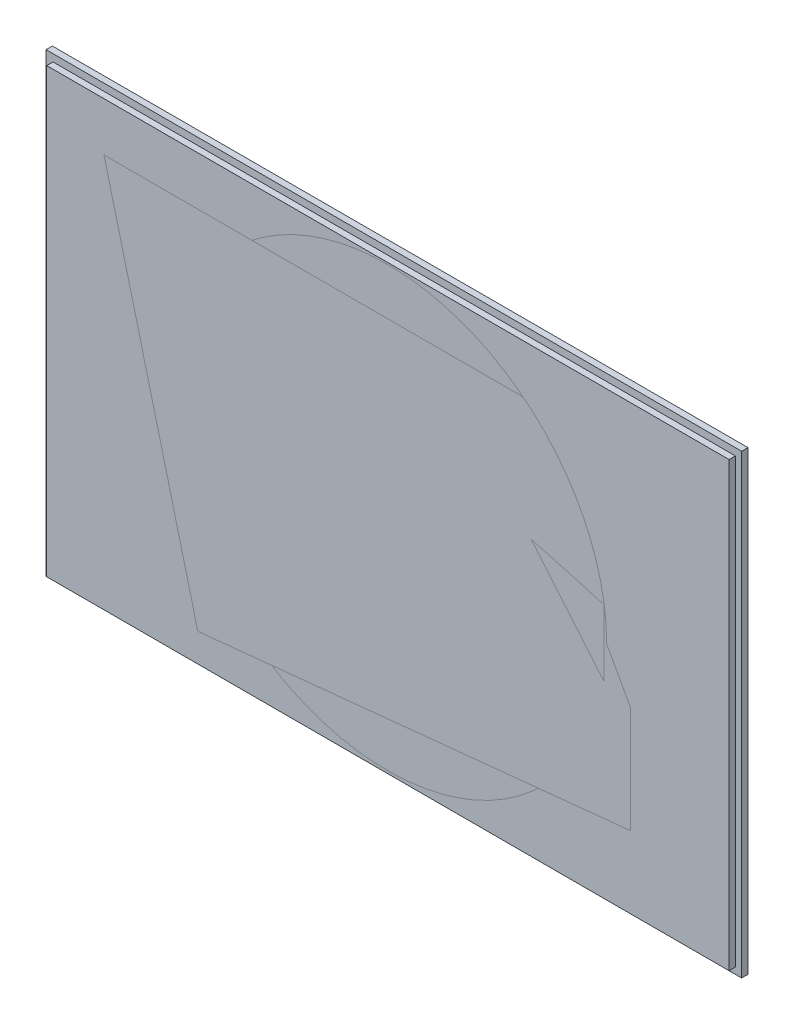
from build123d import *

# Parameters (mm, degrees)
SKETCH1_W           = 219.763537348
SKETCH1_H           = 144.111604492
BOSS_EXTRUDE1_DEPTH = 2
BOSS_EXTRUDE2_DEPTH = 2
SKETCH3_W           = 215.561595081
SKETCH3_H           = 139.864383785
BOSS_EXTRUDE3_DEPTH = 2
SKETCH4_R           = 69.248780579
BOSS_EXTRUDE5_DEPTH = 2
SKETCH4_2_R         = 69.248780579
CUT_EXTRUDE3_DEPTH  = 2


with BuildPart() as part:
    # Sketch1 → Boss-Extrude1 (new body)
    with BuildSketch(Plane.XY):
        Rectangle(SKETCH1_W, SKETCH1_H)
    extrude(amount=BOSS_EXTRUDE1_DEPTH)


with BuildPart() as body_2:
    # Sketch2 → Boss-Extrude2 (new body)
    with BuildSketch(Plane.XY.offset(2)):
        Polygon((-89.566144192, 54.398549486), (86.371391829, 54.398549486), (76.70074348, 8.020636875), (76.70074348, -47.321076556), (-59.92940692, -61.112256167), align=None)
    extrude(amount=BOSS_EXTRUDE2_DEPTH)


with BuildPart() as body_3:
    # Sketch3 → Boss-Extrude3 (new body)
    with BuildSketch(Plane.XY.offset(2)):
        with Locations((0.125326509, -0.125326509)):
            Rectangle(SKETCH3_W, SKETCH3_H)
    extrude(amount=BOSS_EXTRUDE3_DEPTH)

    # Sketch4<2> → Cut-Extrude3 (cut)
    with BuildSketch(Plane.XY.offset(2)):
        Circle(SKETCH4_2_R)
    extrude(amount=CUT_EXTRUDE3_DEPTH, mode=Mode.SUBTRACT)


with BuildPart() as body_4:
    # Sketch4 → Boss-Extrude5 (new body)
    with BuildSketch(Plane.XY.offset(2)):
        Circle(SKETCH4_R)
    extrude(amount=BOSS_EXTRUDE5_DEPTH)


solid = Compound([part.part, body_2.part, body_3.part, body_4.part])
